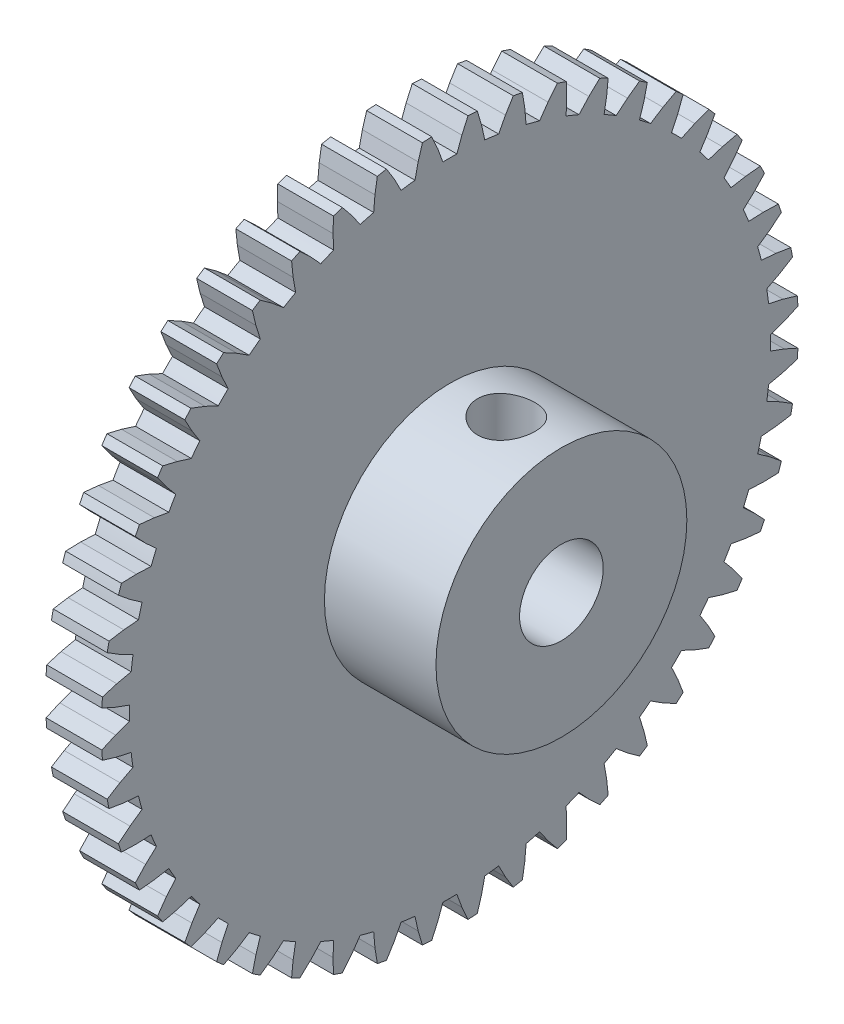
from build123d import *

# Parameters (mm, degrees)
BOSS_EXTRUDE1_DEPTH      = 2
SKETCH2_W                = 4
SKETCH2_H                = 4.5
F_3_0_3_DIAMETER_HOLE1_D = 3
SKETCH5_W                = 1.025000001
SKETCH5_H                = 9


with BuildPart() as part:
    # Sketch1 → Boss-Extrude1 (new body)
    with BuildSketch(Plane(origin=(2, 0, 0), x_dir=(0, 0, -1), z_dir=(1, 0, 0))):
        with BuildLine():
            Line((-11.497263311, -0.250871178), (-11.992256243, -0.431033871))
            Line((-11.992256243, -0.431033871), (-12.483028281, -0.651156621))
            ThreePointArc((-12.483028281, -0.651156621), (-12.473236541, -0.817539115), (-12.461227238, -0.983776262))
            Line((-12.461227238, -0.983776262), (-11.945922039, -1.137957227))
            Line((-11.945922039, -1.137957227), (-11.43164789, -1.251969061))
            ThreePointArc((-11.43164789, -1.251969061), (-11.401615906, -1.50105121), (-11.366157371, -1.749418939))
            Line((-11.366157371, -1.749418939), (-11.833399619, -1.99264986))
            Line((-11.833399619, -1.99264986), (-12.291241249, -2.274948035))
            ThreePointArc((-12.291241249, -2.274948035), (-12.259816005, -2.438629025), (-12.226211142, -2.601876461))
            Line((-12.226211142, -2.601876461), (-11.695189796, -2.687477561))
            Line((-11.695189796, -2.687477561), (-11.170433803, -2.733387762))
            ThreePointArc((-11.170433803, -2.733387762), (-11.108147002, -2.976419018), (-11.040573326, -3.21803366))
            Line((-11.040573326, -3.21803366), (-11.472070246, -3.520171058))
            Line((-11.472070246, -3.520171058), (-11.889147672, -3.859814457))
            ThreePointArc((-11.889147672, -3.859814457), (-11.836626619, -4.017993316), (-11.782001183, -4.175457834))
            Line((-11.782001183, -4.175457834), (-11.244349613, -4.191014409))
            Line((-11.244349613, -4.191014409), (-10.718090497, -4.16803744))
            ThreePointArc((-10.718090497, -4.16803744), (-10.624614624, -4.400859471), (-10.52608201, -4.631586932))
            Line((-10.52608201, -4.631586932), (-10.91445057, -4.987461152))
            Line((-10.91445057, -4.987461152), (-11.283627481, -5.378638384))
            ThreePointArc((-11.283627481, -5.378638384), (-11.210909269, -5.528608628), (-11.136197918, -5.677595965))
            Line((-11.136197918, -5.677595965), (-10.601115491, -5.622841839))
            Line((-10.601115491, -5.622841839), (-10.082357691, -5.531370843))
            ThreePointArc((-10.082357691, -5.531370843), (-9.959292144, -5.75), (-9.831486513, -5.965892468))
            Line((-9.831486513, -5.965892468), (-10.17008162, -6.369414404))
            Line((-10.17008162, -6.369414404), (-10.485041297, -6.805432316))
            ThreePointArc((-10.485041297, -6.805432316), (-10.393370154, -6.944627913), (-10.299851218, -7.082588855))
            Line((-10.299851218, -7.082588855), (-9.776493344, -6.958460886))
            Line((-9.776493344, -6.958460886), (-9.274112949, -6.800060956))
            ThreePointArc((-9.274112949, -6.800060956), (-9.123563413, -7.000756433), (-8.968671556, -7.19811993))
            Line((-8.968671556, -7.19811993), (-9.251699753, -7.642385209))
            Line((-9.251699753, -7.642385209), (-9.507053148, -8.115783415))
            ThreePointArc((-9.507053148, -8.115783415), (-9.397997593, -8.241822689), (-9.287271209, -8.366396686))
            Line((-9.287271209, -8.366396686), (-8.784592685, -8.175018738))
            Line((-8.784592685, -8.175018738), (-8.307185564, -7.952400141))
            ThreePointArc((-8.307185564, -7.952400141), (-8.131727984, -8.131727984), (-7.952400141, -8.307185564))
            Line((-7.952400141, -8.307185564), (-8.175018738, -8.784592685))
            Line((-8.175018738, -8.784592685), (-8.366396684, -9.28727121))
            ThreePointArc((-8.366396684, -9.28727121), (-8.241822688, -9.397997595), (-8.115783413, -9.50705315))
            Line((-8.115783413, -9.50705315), (-7.642385209, -9.251699753))
            Line((-7.642385209, -9.251699753), (-7.19811993, -8.968671556))
            ThreePointArc((-7.19811993, -8.968671556), (-7.000756433, -9.123563414), (-6.800060955, -9.27411295))
            Line((-6.800060955, -9.27411295), (-6.958460886, -9.776493344))
            Line((-6.958460886, -9.776493344), (-7.082588854, -10.299851219))
            ThreePointArc((-7.082588854, -10.299851219), (-6.944627914, -10.393370153), (-6.805432319, -10.485041295))
            Line((-6.805432319, -10.485041295), (-6.369414404, -10.17008162))
            Line((-6.369414404, -10.17008162), (-5.965892469, -9.831486513))
            ThreePointArc((-5.965892469, -9.831486513), (-5.749999999, -9.959292144), (-5.531370841, -10.082357691))
            Line((-5.531370841, -10.082357691), (-5.622841839, -10.601115491))
            Line((-5.622841839, -10.601115491), (-5.677595964, -11.136197918))
            ThreePointArc((-5.677595964, -11.136197918), (-5.528608629, -11.210909269), (-5.378638386, -11.28362748))
            Line((-5.378638386, -11.28362748), (-4.987461152, -10.91445057))
            Line((-4.987461152, -10.91445057), (-4.631586933, -10.52608201))
            ThreePointArc((-4.631586933, -10.52608201), (-4.400859471, -10.624614624), (-4.168037438, -10.718090498))
            Line((-4.168037438, -10.718090498), (-4.191014409, -11.244349613))
            Line((-4.191014409, -11.244349613), (-4.175457834, -11.782001183))
            ThreePointArc((-4.175457834, -11.782001183), (-4.017993317, -11.836626618), (-3.859814459, -11.889147671))
            Line((-3.859814459, -11.889147671), (-3.520171058, -11.472070246))
            Line((-3.520171058, -11.472070246), (-3.218033661, -11.040573325))
            ThreePointArc((-3.218033661, -11.040573325), (-2.97641902, -11.108147002), (-2.733387765, -11.170433802))
            Line((-2.733387765, -11.170433802), (-2.687477561, -11.695189796))
            Line((-2.687477561, -11.695189796), (-2.601876462, -12.226211142))
            ThreePointArc((-2.601876462, -12.226211142), (-2.438629026, -12.259816005), (-2.274948036, -12.291241249))
            Line((-2.274948036, -12.291241249), (-1.99264986, -11.833399619))
            Line((-1.99264986, -11.833399619), (-1.749418941, -11.36615737))
            ThreePointArc((-1.749418941, -11.36615737), (-1.501051212, -11.401615906), (-1.251969063, -11.431647889))
            Line((-1.251969063, -11.431647889), (-1.137957227, -11.945922038))
            Line((-1.137957227, -11.945922038), (-0.983776263, -12.461227238))
            ThreePointArc((-0.983776263, -12.461227238), (-0.817539116, -12.473236541), (-0.651156622, -12.483028281))
            Line((-0.651156622, -12.483028281), (-0.431033871, -11.992256243))
            Line((-0.431033871, -11.992256243), (-0.250871178, -11.497263311))
            ThreePointArc((-0.250871178, -11.497263311), (-1e-09, -11.5), (0.250871176, -11.497263311))
            Line((0.250871176, -11.497263311), (0.431033871, -11.992256243))
            Line((0.431033871, -11.992256243), (0.651156621, -12.483028281))
            ThreePointArc((0.651156621, -12.483028281), (0.817539115, -12.473236541), (0.983776263, -12.461227238))
            Line((0.983776263, -12.461227238), (1.137957227, -11.945922038))
            Line((1.137957227, -11.945922038), (1.251969061, -11.431647889))
            ThreePointArc((1.251969061, -11.431647889), (1.50105121, -11.401615906), (1.74941894, -11.36615737))
            Line((1.74941894, -11.36615737), (1.99264986, -11.833399619))
            Line((1.99264986, -11.833399619), (2.274948035, -12.291241249))
            ThreePointArc((2.274948035, -12.291241249), (2.438629025, -12.259816005), (2.601876463, -12.226211141))
            Line((2.601876463, -12.226211141), (2.687477561, -11.695189796))
            Line((2.687477561, -11.695189796), (2.733387762, -11.170433803))
            ThreePointArc((2.733387762, -11.170433803), (2.976419018, -11.108147002), (3.218033661, -11.040573325))
            Line((3.218033661, -11.040573325), (3.520171058, -11.472070246))
            Line((3.520171058, -11.472070246), (3.859814457, -11.889147672))
            ThreePointArc((3.859814457, -11.889147672), (4.017993317, -11.836626619), (4.175457835, -11.782001183))
            Line((4.175457835, -11.782001183), (4.191014409, -11.244349613))
            Line((4.191014409, -11.244349613), (4.16803744, -10.718090497))
            ThreePointArc((4.16803744, -10.718090497), (4.400859472, -10.624614624), (4.631586933, -10.52608201))
            Line((4.631586933, -10.52608201), (4.987461152, -10.91445057))
            Line((4.987461152, -10.91445057), (5.378638384, -11.283627481))
            ThreePointArc((5.378638384, -11.283627481), (5.528608629, -11.210909269), (5.677595966, -11.136197917))
            Line((5.677595966, -11.136197917), (5.622841839, -10.601115491))
            Line((5.622841839, -10.601115491), (5.531370843, -10.08235769))
            ThreePointArc((5.531370843, -10.08235769), (5.75, -9.959292143), (5.965892469, -9.831486512))
            Line((5.965892469, -9.831486512), (6.369414404, -10.17008162))
            Line((6.369414404, -10.17008162), (6.805432316, -10.485041296))
            ThreePointArc((6.805432316, -10.485041296), (6.944627914, -10.393370153), (7.082588856, -10.299851217))
            Line((7.082588856, -10.299851217), (6.958460886, -9.776493344))
            Line((6.958460886, -9.776493344), (6.800060956, -9.274112949))
            ThreePointArc((6.800060956, -9.274112949), (7.000756434, -9.123563413), (7.198119931, -8.968671555))
            Line((7.198119931, -8.968671555), (7.642385209, -9.251699753))
            Line((7.642385209, -9.251699753), (8.115783415, -9.507053148))
            ThreePointArc((8.115783415, -9.507053148), (8.241822687, -9.397997595), (8.366396682, -9.287271212))
            Line((8.366396682, -9.287271212), (8.175018738, -8.784592685))
            Line((8.175018738, -8.784592685), (7.952400141, -8.307185564))
            ThreePointArc((7.952400141, -8.307185564), (8.131727984, -8.131727983), (8.307185565, -7.95240014))
            Line((8.307185565, -7.95240014), (8.784592685, -8.175018738))
            Line((8.784592685, -8.175018738), (9.28727121, -8.366396684))
            ThreePointArc((9.28727121, -8.366396684), (9.397997593, -8.24182269), (9.507053146, -8.115783417))
            Line((9.507053146, -8.115783417), (9.251699753, -7.642385209))
            Line((9.251699753, -7.642385209), (8.968671556, -7.19811993))
            ThreePointArc((8.968671556, -7.19811993), (9.123563414, -7.000756432), (9.27411295, -6.800060954))
            Line((9.27411295, -6.800060954), (9.776493344, -6.958460886))
            Line((9.776493344, -6.958460886), (10.299851219, -7.082588854))
            ThreePointArc((10.299851219, -7.082588854), (10.393370153, -6.944627914), (10.485041295, -6.805432318))
            Line((10.485041295, -6.805432318), (10.17008162, -6.369414404))
            Line((10.17008162, -6.369414404), (9.831486513, -5.965892469))
            ThreePointArc((9.831486513, -5.965892469), (9.959292143, -5.750000001), (10.082357689, -5.531370845))
            Line((10.082357689, -5.531370845), (10.601115491, -5.622841839))
            Line((10.601115491, -5.622841839), (11.136197918, -5.677595964))
            ThreePointArc((11.136197918, -5.677595964), (11.210909269, -5.528608628), (11.283627481, -5.378638385))
            Line((11.283627481, -5.378638385), (10.91445057, -4.987461152))
            Line((10.91445057, -4.987461152), (10.52608201, -4.631586933))
            ThreePointArc((10.52608201, -4.631586933), (10.624614623, -4.400859473), (10.718090496, -4.168037442))
            Line((10.718090496, -4.168037442), (11.244349613, -4.191014409))
            Line((11.244349613, -4.191014409), (11.782001183, -4.175457834))
            ThreePointArc((11.782001183, -4.175457834), (11.836626619, -4.017993317), (11.889147671, -3.859814458))
            Line((11.889147671, -3.859814458), (11.472070246, -3.520171058))
            Line((11.472070246, -3.520171058), (11.040573325, -3.218033661))
            ThreePointArc((11.040573325, -3.218033661), (11.108147002, -2.976419019), (11.170433802, -2.733387763))
            Line((11.170433802, -2.733387763), (11.695189796, -2.687477561))
            Line((11.695189796, -2.687477561), (12.226211141, -2.601876462))
            ThreePointArc((12.226211141, -2.601876462), (12.259816005, -2.438629025), (12.291241249, -2.274948035))
            Line((12.291241249, -2.274948035), (11.833399619, -1.99264986))
            Line((11.833399619, -1.99264986), (11.36615737, -1.749418941))
            ThreePointArc((11.36615737, -1.749418941), (11.401615906, -1.501051211), (11.431647889, -1.251969062))
            Line((11.431647889, -1.251969062), (11.945922038, -1.137957227))
            Line((11.945922038, -1.137957227), (12.461227237, -0.983776263))
            ThreePointArc((12.461227237, -0.983776263), (12.47323654, -0.817539115), (12.483028281, -0.65115662))
            Line((12.483028281, -0.65115662), (11.992256243, -0.431033871))
            Line((11.992256243, -0.431033871), (11.497263311, -0.250871178))
            ThreePointArc((11.497263311, -0.250871178), (11.5, 0), (11.497263311, 0.250871178))
            Line((11.497263311, 0.250871178), (11.992256243, 0.431033871))
            Line((11.992256243, 0.431033871), (12.483028281, 0.651156622))
            ThreePointArc((12.483028281, 0.651156622), (12.47323654, 0.817539116), (12.461227237, 0.983776263))
            Line((12.461227237, 0.983776263), (11.945922038, 1.137957227))
            Line((11.945922038, 1.137957227), (11.431647889, 1.251969063))
            ThreePointArc((11.431647889, 1.251969063), (11.401615905, 1.501051212), (11.36615737, 1.749418941))
            Line((11.36615737, 1.749418941), (11.833399619, 1.99264986))
            Line((11.833399619, 1.99264986), (12.291241249, 2.274948036))
            ThreePointArc((12.291241249, 2.274948036), (12.259816005, 2.438629026), (12.226211141, 2.601876462))
            Line((12.226211141, 2.601876462), (11.695189796, 2.687477561))
            Line((11.695189796, 2.687477561), (11.170433802, 2.733387764))
            ThreePointArc((11.170433802, 2.733387764), (11.108147002, 2.97641902), (11.040573325, 3.218033661))
            Line((11.040573325, 3.218033661), (11.472070246, 3.520171058))
            Line((11.472070246, 3.520171058), (11.889147671, 3.859814459))
            ThreePointArc((11.889147671, 3.859814459), (11.836626618, 4.017993317), (11.782001183, 4.175457834))
            Line((11.782001183, 4.175457834), (11.244349613, 4.191014409))
            Line((11.244349613, 4.191014409), (10.718090498, 4.168037438))
            ThreePointArc((10.718090498, 4.168037438), (10.624614624, 4.400859471), (10.52608201, 4.631586933))
            Line((10.52608201, 4.631586933), (10.91445057, 4.987461152))
            Line((10.91445057, 4.987461152), (11.28362748, 5.378638386))
            ThreePointArc((11.28362748, 5.378638386), (11.210909269, 5.528608629), (11.136197918, 5.677595964))
            Line((11.136197918, 5.677595964), (10.601115491, 5.622841839))
            Line((10.601115491, 5.622841839), (10.082357691, 5.531370841))
            ThreePointArc((10.082357691, 5.531370841), (9.959292144, 5.749999999), (9.831486513, 5.965892469))
            Line((9.831486513, 5.965892469), (10.17008162, 6.369414404))
            Line((10.17008162, 6.369414404), (10.485041295, 6.805432319))
            ThreePointArc((10.485041295, 6.805432319), (10.393370153, 6.944627914), (10.299851219, 7.082588854))
            Line((10.299851219, 7.082588854), (9.776493344, 6.958460886))
            Line((9.776493344, 6.958460886), (9.27411295, 6.800060955))
            ThreePointArc((9.27411295, 6.800060955), (9.123563414, 7.000756433), (8.968671556, 7.19811993))
            Line((8.968671556, 7.19811993), (9.251699753, 7.642385209))
            Line((9.251699753, 7.642385209), (9.50705315, 8.115783413))
            ThreePointArc((9.50705315, 8.115783413), (9.397997595, 8.241822688), (9.28727121, 8.366396684))
            Line((9.28727121, 8.366396684), (8.784592685, 8.175018738))
            Line((8.784592685, 8.175018738), (8.307185564, 7.952400141))
            ThreePointArc((8.307185564, 7.952400141), (8.131727984, 8.131727983), (7.952400141, 8.307185564))
            Line((7.952400141, 8.307185564), (8.175018738, 8.784592685))
            Line((8.175018738, 8.784592685), (8.366396686, 9.287271208))
            ThreePointArc((8.366396686, 9.287271208), (8.241822689, 9.397997593), (8.115783415, 9.507053148))
            Line((8.115783415, 9.507053148), (7.642385209, 9.251699753))
            Line((7.642385209, 9.251699753), (7.19811993, 8.968671555))
            ThreePointArc((7.19811993, 8.968671555), (7.000756433, 9.123563413), (6.800060956, 9.274112949))
            Line((6.800060956, 9.274112949), (6.958460886, 9.776493344))
            Line((6.958460886, 9.776493344), (7.082588855, 10.299851218))
            ThreePointArc((7.082588855, 10.299851218), (6.944627913, 10.393370153), (6.805432316, 10.485041296))
            Line((6.805432316, 10.485041296), (6.369414404, 10.17008162))
            Line((6.369414404, 10.17008162), (5.965892468, 9.831486513))
            ThreePointArc((5.965892468, 9.831486513), (5.75, 9.959292143), (5.531370843, 10.08235769))
            Line((5.531370843, 10.08235769), (5.622841839, 10.601115491))
            Line((5.622841839, 10.601115491), (5.677595965, 11.136197918))
            ThreePointArc((5.677595965, 11.136197918), (5.528608628, 11.210909269), (5.378638384, 11.283627481))
            Line((5.378638384, 11.283627481), (4.987461152, 10.91445057))
            Line((4.987461152, 10.91445057), (4.631586932, 10.52608201))
            ThreePointArc((4.631586932, 10.52608201), (4.400859471, 10.624614624), (4.16803744, 10.718090497))
            Line((4.16803744, 10.718090497), (4.191014409, 11.244349613))
            Line((4.191014409, 11.244349613), (4.175457834, 11.782001183))
            ThreePointArc((4.175457834, 11.782001183), (4.017993316, 11.836626619), (3.859814457, 11.889147672))
            Line((3.859814457, 11.889147672), (3.520171058, 11.472070246))
            Line((3.520171058, 11.472070246), (3.21803366, 11.040573326))
            ThreePointArc((3.21803366, 11.040573326), (2.976419018, 11.108147002), (2.733387762, 11.170433803))
            Line((2.733387762, 11.170433803), (2.687477561, 11.695189796))
            Line((2.687477561, 11.695189796), (2.601876461, 12.226211142))
            ThreePointArc((2.601876461, 12.226211142), (2.438629025, 12.259816005), (2.274948035, 12.291241249))
            Line((2.274948035, 12.291241249), (1.99264986, 11.833399619))
            Line((1.99264986, 11.833399619), (1.749418939, 11.366157371))
            ThreePointArc((1.749418939, 11.366157371), (1.50105121, 11.401615906), (1.251969061, 11.431647889))
            Line((1.251969061, 11.431647889), (1.137957227, 11.945922038))
            Line((1.137957227, 11.945922038), (0.983776262, 12.461227238))
            ThreePointArc((0.983776262, 12.461227238), (0.817539115, 12.473236541), (0.651156621, 12.483028281))
            Line((0.651156621, 12.483028281), (0.431033871, 11.992256243))
            Line((0.431033871, 11.992256243), (0.250871175, 11.497263311))
            ThreePointArc((0.250871175, 11.497263311), (-1e-09, 11.5), (-0.250871178, 11.497263311))
            Line((-0.250871178, 11.497263311), (-0.431033871, 11.992256243))
            Line((-0.431033871, 11.992256243), (-0.651156623, 12.483028281))
            ThreePointArc((-0.651156623, 12.483028281), (-0.817539116, 12.473236541), (-0.983776263, 12.461227238))
            Line((-0.983776263, 12.461227238), (-1.137957227, 11.945922038))
            Line((-1.137957227, 11.945922038), (-1.251969058, 11.43164789))
            ThreePointArc((-1.251969058, 11.43164789), (-1.501051209, 11.401615906), (-1.749418941, 11.36615737))
            Line((-1.749418941, 11.36615737), (-1.99264986, 11.833399619))
            Line((-1.99264986, 11.833399619), (-2.274948037, 12.291241249))
            ThreePointArc((-2.274948037, 12.291241249), (-2.438629026, 12.259816005), (-2.601876462, 12.226211142))
            Line((-2.601876462, 12.226211142), (-2.687477561, 11.695189796))
            Line((-2.687477561, 11.695189796), (-2.73338776, 11.170433803))
            ThreePointArc((-2.73338776, 11.170433803), (-2.976419018, 11.108147002), (-3.218033661, 11.040573325))
            Line((-3.218033661, 11.040573325), (-3.520171058, 11.472070246))
            Line((-3.520171058, 11.472070246), (-3.85981446, 11.889147671))
            ThreePointArc((-3.85981446, 11.889147671), (-4.017993318, 11.836626618), (-4.175457834, 11.782001183))
            Line((-4.175457834, 11.782001183), (-4.191014409, 11.244349613))
            Line((-4.191014409, 11.244349613), (-4.168037439, 10.718090497))
            ThreePointArc((-4.168037439, 10.718090497), (-4.400859471, 10.624614624), (-4.631586933, 10.52608201))
            Line((-4.631586933, 10.52608201), (-4.987461152, 10.91445057))
            Line((-4.987461152, 10.91445057), (-5.378638382, 11.283627482))
            ThreePointArc((-5.378638382, 11.283627482), (-5.528608627, 11.21090927), (-5.677595964, 11.136197918))
            Line((-5.677595964, 11.136197918), (-5.622841839, 10.601115491))
            Line((-5.622841839, 10.601115491), (-5.531370842, 10.082357691))
            ThreePointArc((-5.531370842, 10.082357691), (-5.75, 9.959292144), (-5.965892469, 9.831486513))
            Line((-5.965892469, 9.831486513), (-6.369414404, 10.17008162))
            Line((-6.369414404, 10.17008162), (-6.805432315, 10.485041298))
            ThreePointArc((-6.805432315, 10.485041298), (-6.944627912, 10.393370154), (-7.082588854, 10.299851219))
            Line((-7.082588854, 10.299851219), (-6.958460886, 9.776493344))
            Line((-6.958460886, 9.776493344), (-6.800060956, 9.274112949))
            ThreePointArc((-6.800060956, 9.274112949), (-7.000756433, 9.123563414), (-7.19811993, 8.968671556))
            Line((-7.19811993, 8.968671556), (-7.642385209, 9.251699753))
            Line((-7.642385209, 9.251699753), (-8.115783414, 9.507053149))
            ThreePointArc((-8.115783414, 9.507053149), (-8.241822688, 9.397997594), (-8.366396684, 9.28727121))
            Line((-8.366396684, 9.28727121), (-8.175018738, 8.784592685))
            Line((-8.175018738, 8.784592685), (-7.952400142, 8.307185564))
            ThreePointArc((-7.952400142, 8.307185564), (-8.131727984, 8.131727983), (-8.307185564, 7.952400141))
            Line((-8.307185564, 7.952400141), (-8.784592685, 8.175018738))
            Line((-8.784592685, 8.175018738), (-9.287271209, 8.366396685))
            ThreePointArc((-9.287271209, 8.366396685), (-9.397997594, 8.241822689), (-9.507053148, 8.115783415))
            Line((-9.507053148, 8.115783415), (-9.251699753, 7.642385209))
            Line((-9.251699753, 7.642385209), (-8.968671556, 7.198119929))
            ThreePointArc((-8.968671556, 7.198119929), (-9.123563414, 7.000756433), (-9.274112949, 6.800060956))
            Line((-9.274112949, 6.800060956), (-9.776493344, 6.958460886))
            Line((-9.776493344, 6.958460886), (-10.299851219, 7.082588854))
            ThreePointArc((-10.299851219, 7.082588854), (-10.393370154, 6.944627913), (-10.485041297, 6.805432316))
            Line((-10.485041297, 6.805432316), (-10.17008162, 6.369414404))
            Line((-10.17008162, 6.369414404), (-9.831486514, 5.965892468))
            ThreePointArc((-9.831486514, 5.965892468), (-9.959292144, 5.749999999), (-10.082357691, 5.531370843))
            Line((-10.082357691, 5.531370843), (-10.601115491, 5.622841839))
            Line((-10.601115491, 5.622841839), (-11.136197918, 5.677595964))
            ThreePointArc((-11.136197918, 5.677595964), (-11.210909269, 5.528608628), (-11.283627481, 5.378638384))
            Line((-11.283627481, 5.378638384), (-10.91445057, 4.987461152))
            Line((-10.91445057, 4.987461152), (-10.526082011, 4.631586931))
            ThreePointArc((-10.526082011, 4.631586931), (-10.624614624, 4.400859471), (-10.718090497, 4.16803744))
            Line((-10.718090497, 4.16803744), (-11.244349613, 4.191014409))
            Line((-11.244349613, 4.191014409), (-11.782001184, 4.175457833))
            ThreePointArc((-11.782001184, 4.175457833), (-11.836626619, 4.017993316), (-11.889147672, 3.859814457))
            Line((-11.889147672, 3.859814457), (-11.472070246, 3.520171058))
            Line((-11.472070246, 3.520171058), (-11.040573326, 3.218033659))
            ThreePointArc((-11.040573326, 3.218033659), (-11.108147003, 2.976419018), (-11.170433803, 2.733387762))
            Line((-11.170433803, 2.733387762), (-11.695189796, 2.687477561))
            Line((-11.695189796, 2.687477561), (-12.226211142, 2.60187646))
            ThreePointArc((-12.226211142, 2.60187646), (-12.259816005, 2.438629024), (-12.291241249, 2.274948035))
            Line((-12.291241249, 2.274948035), (-11.833399619, 1.99264986))
            Line((-11.833399619, 1.99264986), (-11.36615737, 1.749418944))
            ThreePointArc((-11.36615737, 1.749418944), (-11.401615906, 1.501051212), (-11.43164789, 1.251969061))
            Line((-11.43164789, 1.251969061), (-11.945922038, 1.137957227))
            Line((-11.945922038, 1.137957227), (-12.461227238, 0.983776261))
            ThreePointArc((-12.461227238, 0.983776261), (-12.473236541, 0.817539114), (-12.483028281, 0.651156621))
            Line((-12.483028281, 0.651156621), (-11.992256243, 0.431033871))
            Line((-11.992256243, 0.431033871), (-11.497263311, 0.25087118))
            ThreePointArc((-11.497263311, 0.25087118), (-11.5, 1e-09), (-11.497263311, -0.250871178))
        make_face()
    extrude(amount=-BOSS_EXTRUDE1_DEPTH)

    # Sketch2 → Revolve1 (revolve)
    with BuildSketch(Plane.XY, mode=Mode.PRIVATE) as revolve1_sk:
        with Locations((4, 2.25)):
            Rectangle(SKETCH2_W, SKETCH2_H)
    revolve(revolve1_sk.sketch.rotate(Axis((2, 0, 0), (1, 0, 0)), 270), axis=Axis((2, 0, 0), (1, 0, 0)))

    # Ø3.0 (3) Diameter Hole1 (through all)
    with Locations(Plane(origin=(6, 0, 0), x_dir=(0, 0, -1), z_dir=(1, 0, 0))):
        with Locations((0, 0)):
            Hole(F_3_0_3_DIAMETER_HOLE1_D / 2)

    # Sketch5 → Ø2.05 (2.05) Diameter Hole1 (revolve, cut)
    with BuildSketch(Plane(origin=(4, 1.095142532, -0.006150956), x_dir=(0, -0.0056164917039993115, -0.999984227386082), z_dir=(1, 0, 0))):
        with Locations((0.5125, 4.5)):
            Rectangle(SKETCH5_W, SKETCH5_H)
    revolve(axis=Axis((4, -5.254757312, 0.029513766), (0, 0.9999842273860818, -0.005616491703999311)), mode=Mode.SUBTRACT)


solid = part.part
